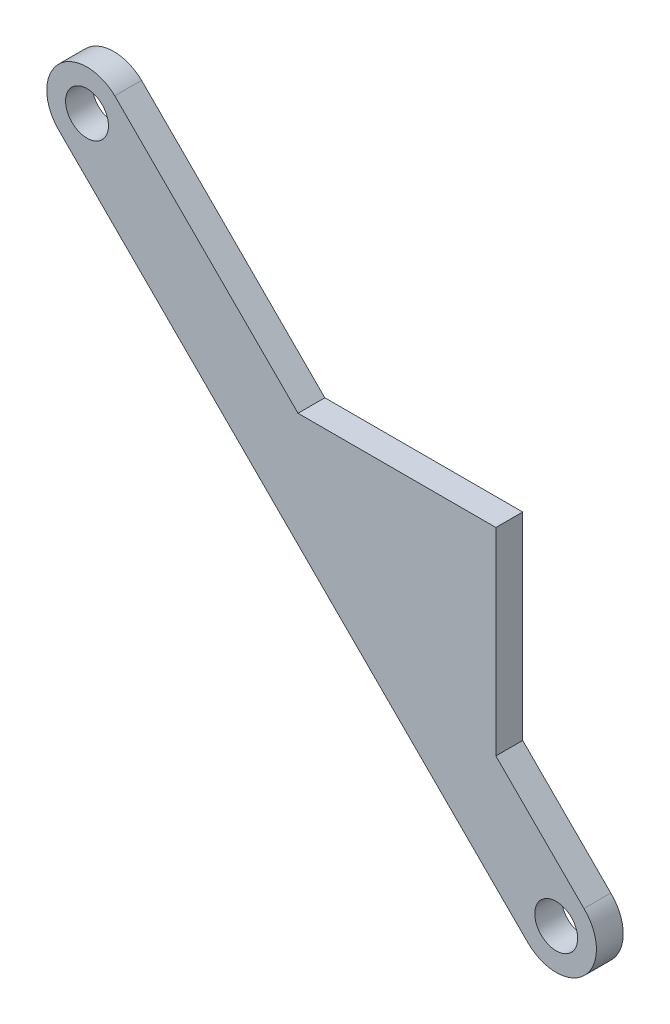
from build123d import *

# Parameters (mm, degrees)
SKETCH_1_R      = 1.6
EXTRUDE_1_DEPTH = 2


with BuildPart() as part:
    # Эскиз1 → Бобышка-Вытянуть1 (new body)
    with BuildSketch(Plane.XY):
        with BuildLine():
            Line((0, -4.241468847), (2.758531153, -7))
            Line((2.758531153, -7), (15.329410732, -19.570879578))
            Line((15.329410732, -19.570879578), (15.429120422, -19.670589268))
            ThreePointArc((15.429120422, -19.670589268), (19.670589268, -19.570879578), (19.570879578, -15.329410732))
            Line((19.570879578, -15.329410732), (13, -8.758531153))
            Line((13, -8.758531153), (13, 6))
            Line((13, 6), (-1.758531153, 6))
            Line((-1.758531153, 6), (-15.329410732, 19.570879578))
            Line((-15.329410732, 19.570879578), (-15.429120422, 19.670589268))
            ThreePointArc((-15.429120422, 19.670589268), (-19.670589268, 19.570879578), (-19.570879578, 15.329410732))
            Line((-19.570879578, 15.329410732), (0, -4.241468847))
        make_face()
        with Locations((17.5, -17.5)):
            Circle(SKETCH_1_R, mode=Mode.SUBTRACT)
        with Locations((-17.5, 17.5)):
            Circle(SKETCH_1_R, mode=Mode.SUBTRACT)
    extrude(amount=EXTRUDE_1_DEPTH)


solid = part.part
